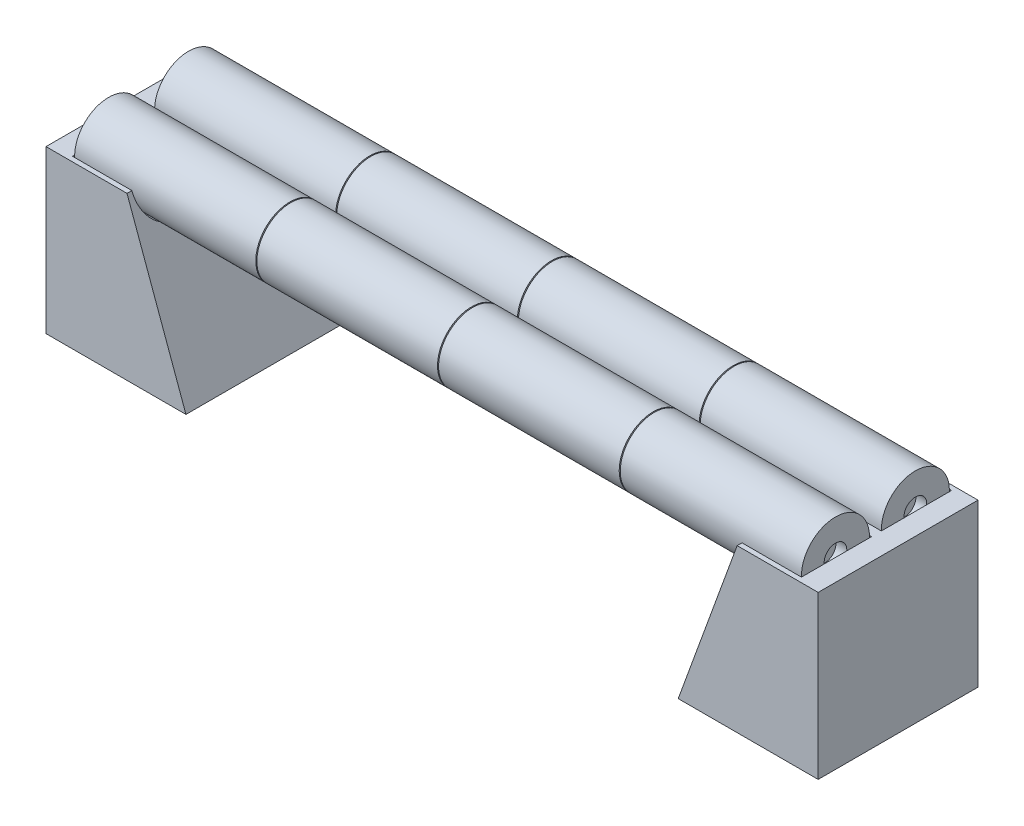
from build123d import *

# Parameters (mm, degrees)
BOSS_EXTRUDE1_DEPTH          = 14.8
CUT_EXTRUDE1_START           = -4
SKETCH2_R                    = 6.5
CUT_EXTRUDE1_DEPTH           = 29.6
BOSS_EXTRUDE2_START          = 0.2
SKETCH3_R                    = 6.3
BOSS_EXTRUDE2_DEPTH          = 134.6
BOSS_EXTRUDE2_2_DEPTH        = 134.6
CUT_EXTRUDE_THIN1_DEPTH      = 82.54127789
CUT_EXTRUDE_THIN1_DEPTH_BACK = 82.54127789
SKETCH5_R                    = 2.1
CUT_EXTRUDE2_DEPTH           = 2
LPATTERN1_COUNT              = 5
LPATTERN1_PITCH              = 33.75


with BuildPart() as part:
    # Sketch1 → Boss-Extrude1 (new, symmetric)
    with BuildSketch(Plane.XY):
        Polygon((-71.5, 0), (-71.5, 30), (-56.5, 30), (-45.580892972, 0), align=None)
    extrude(amount=BOSS_EXTRUDE1_DEPTH, both=True)

    # Sketch2 → Cut-Extrude1 (cut)
    with BuildSketch(Plane.ZY.offset(71.5).offset(CUT_EXTRUDE1_START)):
        with Locations((-7.4, 30)):
            Circle(SKETCH2_R)
        with Locations((7.4, 30)):
            Circle(SKETCH2_R)
    extrude(amount=-CUT_EXTRUDE1_DEPTH, mode=Mode.SUBTRACT)


with BuildPart() as body_2:
    # Mirror3: mirrored copy
    add(part.part.mirror(Plane(origin=(0, 0, 0), x_dir=(0, 0, 1), z_dir=(1, 0, 0))))


with BuildPart() as body_3:
    # Sketch3 → Boss-Extrude2 (new body)
    with BuildSketch(Plane(origin=(-67.5, 0, 0), x_dir=(0, 0, -1), z_dir=(1, 0, 0)).offset(BOSS_EXTRUDE2_START)):
        with Locations((-7.4, 30)):
            Circle(SKETCH3_R)
    extrude(amount=BOSS_EXTRUDE2_DEPTH)


with BuildPart() as body_4:
    # Sketch3 → Boss-Extrude2 2 (new body)
    with BuildSketch(Plane(origin=(-67.5, 0, 0), x_dir=(0, 0, -1), z_dir=(1, 0, 0)).offset(BOSS_EXTRUDE2_START)):
        with Locations((7.4, 30)):
            Circle(SKETCH3_R)
    extrude(amount=BOSS_EXTRUDE2_2_DEPTH)


with BuildPart() as cut_extrude_thin1_tool:
    # Sketch4 → Cut-Extrude-Thin1 (new, two sides: drawn at the far end of the back side and taken through both)
    with BuildSketch(Plane.XY.offset(-CUT_EXTRUDE_THIN1_DEPTH_BACK)):
        Polygon((-33.75, 44.943416657), (-33.75, 10.115026606), (33.75, 10.115026606), (33.75, 45.043416657), (-0.1, 45.043416657), (-0.1, 14.440142309), (0.1, 14.440142309), (0.1, 44.843416657), (33.55, 44.843416657), (33.55, 10.315026606), (-33.55, 10.315026606), (-33.55, 44.943416657), align=None)
    extrude(amount=CUT_EXTRUDE_THIN1_DEPTH + CUT_EXTRUDE_THIN1_DEPTH_BACK)


with BuildPart() as body_3_1:
    add(body_3.part)

    # Cut-Extrude-Thin1: cut by cut_extrude_thin1_tool
    add(cut_extrude_thin1_tool.part, mode=Mode.SUBTRACT)


with BuildPart() as body_4_1:
    add(body_4.part)

    # Cut-Extrude-Thin1: cut by cut_extrude_thin1_tool
    add(cut_extrude_thin1_tool.part, mode=Mode.SUBTRACT)


with BuildPart() as cut_extrude_thin1_piece_1:
    # of the separate pieces the step leaves, piece 1, a body of its own (cut_extrude_thin1_pieces)
    add(body_3_1.part.solids().sort_by_distance((33.75, 30, 1.1))[0])


with BuildPart() as cut_extrude_thin1_piece_2:
    # of the separate pieces the step leaves, piece 2, a body of its own (cut_extrude_thin1_pieces)
    add(body_3_1.part.solids().sort_by_distance((-67.3, 30, 1.1))[0])


with BuildPart() as cut_extrude_thin1_piece_3:
    # of the separate pieces the step leaves, piece 3, a body of its own (cut_extrude_thin1_pieces)
    add(body_3_1.part.solids().sort_by_distance((-33.55, 30, 1.1))[0])


with BuildPart() as cut_extrude_thin1_piece_4:
    # of the separate pieces the step leaves, piece 4, a body of its own (cut_extrude_thin1_pieces)
    add(body_3_1.part.solids().sort_by_distance((0.1, 30, 1.1))[0])


with BuildPart() as cut_extrude_thin1_piece_1_of_body_4:
    # of the separate pieces the step leaves, piece 1, a body of its own (cut_extrude_thin1_pieces_of_body_4)
    add(body_4_1.part.solids().sort_by_distance((33.75, 30, -13.7))[0])


with BuildPart() as cut_extrude_thin1_piece_2_of_body_4:
    # of the separate pieces the step leaves, piece 2, a body of its own (cut_extrude_thin1_pieces_of_body_4)
    add(body_4_1.part.solids().sort_by_distance((-67.3, 30, -13.7))[0])


with BuildPart() as cut_extrude_thin1_piece_3_of_body_4:
    # of the separate pieces the step leaves, piece 3, a body of its own (cut_extrude_thin1_pieces_of_body_4)
    add(body_4_1.part.solids().sort_by_distance((-33.55, 30, -13.7))[0])


with BuildPart() as cut_extrude_thin1_piece_4_of_body_4:
    # of the separate pieces the step leaves, piece 4, a body of its own (cut_extrude_thin1_pieces_of_body_4)
    add(body_4_1.part.solids().sort_by_distance((0.1, 30, -13.7))[0])


with BuildPart() as cut_extrude2_tool:
    # Sketch5 → Cut-Extrude2 (new, symmetric)
    with BuildSketch(Plane(origin=(67.3, 0, 0), x_dir=(0, 0, -1), z_dir=(1, 0, 0))):
        with Locations((-7.4, 30)):
            Circle(SKETCH5_R)
        with Locations((7.4, 30)):
            Circle(SKETCH5_R)
    cut_extrude2 = extrude(amount=CUT_EXTRUDE2_DEPTH, both=True)


with BuildPart() as cut_extrude_thin1_piece_1_1:
    add(cut_extrude_thin1_piece_1.part)

    # Cut-Extrude2: cut by cut_extrude2_tool
    add(cut_extrude2_tool.part, mode=Mode.SUBTRACT)


with BuildPart() as cut_extrude_thin1_piece_1_of_body_4_1:
    add(cut_extrude_thin1_piece_1_of_body_4.part)

    # Cut-Extrude2: cut by cut_extrude2_tool
    add(cut_extrude2_tool.part, mode=Mode.SUBTRACT)


with BuildPart() as lpattern1_tool:
    # LPattern1: Cut-Extrude2 ×5
    with Locations(*[(-i * LPATTERN1_PITCH, 0, 0) for i in range(1, LPATTERN1_COUNT)]):
        add(cut_extrude2)


with BuildPart() as cut_extrude_thin1_piece_2_of_body_4_1:
    add(cut_extrude_thin1_piece_2_of_body_4.part)

    # LPattern1: cut by lpattern1_tool
    add(lpattern1_tool.part, mode=Mode.SUBTRACT)


with BuildPart() as cut_extrude_thin1_piece_2_1:
    add(cut_extrude_thin1_piece_2.part)

    # LPattern1: cut by lpattern1_tool
    add(lpattern1_tool.part, mode=Mode.SUBTRACT)


with BuildPart() as cut_extrude_thin1_piece_4_of_body_4_1:
    add(cut_extrude_thin1_piece_4_of_body_4.part)

    # LPattern1: cut by lpattern1_tool
    add(lpattern1_tool.part, mode=Mode.SUBTRACT)


with BuildPart() as cut_extrude_thin1_piece_4_1:
    add(cut_extrude_thin1_piece_4.part)

    # LPattern1: cut by lpattern1_tool
    add(lpattern1_tool.part, mode=Mode.SUBTRACT)


with BuildPart() as cut_extrude_thin1_piece_3_of_body_4_1:
    add(cut_extrude_thin1_piece_3_of_body_4.part)

    # LPattern1: cut by lpattern1_tool
    add(lpattern1_tool.part, mode=Mode.SUBTRACT)


with BuildPart() as cut_extrude_thin1_piece_3_1:
    add(cut_extrude_thin1_piece_3.part)

    # LPattern1: cut by lpattern1_tool
    add(lpattern1_tool.part, mode=Mode.SUBTRACT)


solid = Compound([part.part, body_2.part, cut_extrude_thin1_piece_1_1.part, cut_extrude_thin1_piece_1_of_body_4_1.part, cut_extrude_thin1_piece_2_of_body_4_1.part, cut_extrude_thin1_piece_2_1.part, cut_extrude_thin1_piece_4_of_body_4_1.part, cut_extrude_thin1_piece_4_1.part, cut_extrude_thin1_piece_3_of_body_4_1.part, cut_extrude_thin1_piece_3_1.part])
